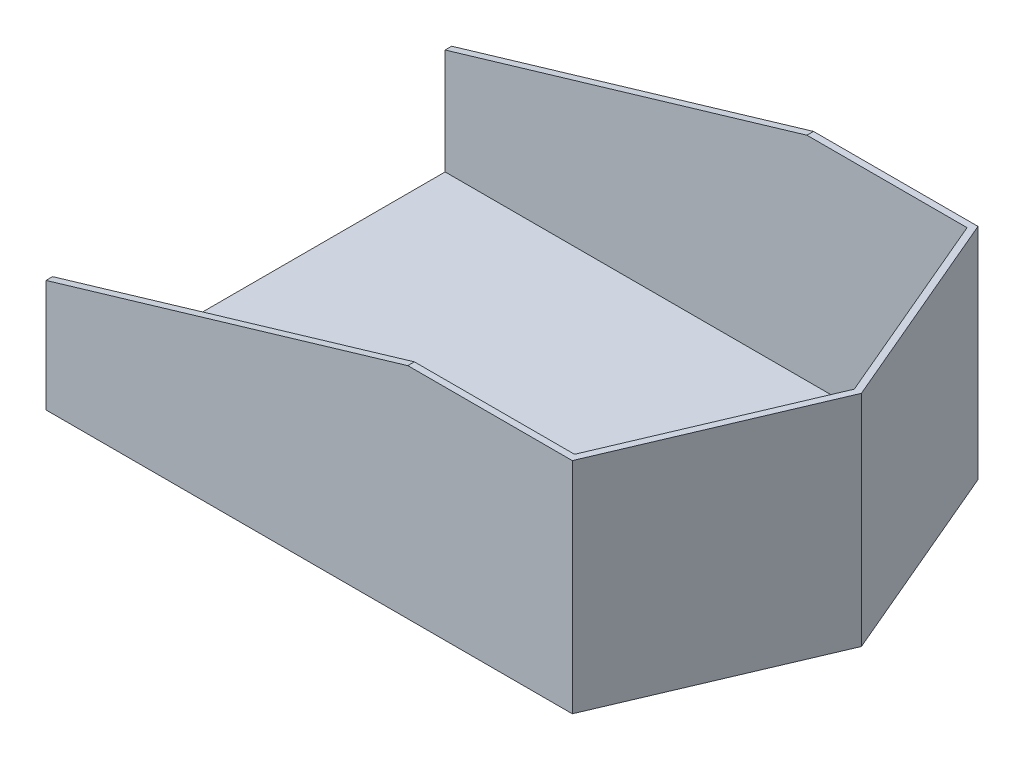
from build123d import *

# Parameters (mm, degrees)
BOSS_EXTRUDE1_DEPTH = 100
SHELL1_T            = -3
SKETCH2_W           = 3
SKETCH2_H           = 179
CUT_EXTRUDE1_DEPTH  = 97
CUT_EXTRUDE2_DEPTH  = 350.650985941


with BuildPart() as part:
    # Sketch1 → Boss-Extrude1 (new body)
    with BuildSketch(Plane(origin=(0, 0, 0), x_dir=(1, 0, 0), z_dir=(0, 1, 0))):
        Polygon((240, 185), (279.339957703, 92.5), (240, 0), (0, 0), (0, 185), align=None)
    extrude(amount=BOSS_EXTRUDE1_DEPTH)

    # Shell1
    shell1_openings = [part.faces().sort_by_distance(p)[0] for p in [
        (130.08332263, 100, -92.5),
    ]]
    offset(amount=SHELL1_T, openings=shell1_openings, kind=Kind.INTERSECTION)

    # Sketch2 → Cut-Extrude1 (cut)
    with BuildSketch(Plane(origin=(0, 100, 0), x_dir=(1, 0, 0), z_dir=(0, 1, 0))):
        with Locations((1.5, 92.5)):
            Rectangle(SKETCH2_W, SKETCH2_H)
    extrude(amount=-CUT_EXTRUDE1_DEPTH, mode=Mode.SUBTRACT)

    # Sketch3 → Cut-Extrude2 (cut, through all)
    with BuildSketch(Plane.XY):
        Polygon((0, 100), (0, 51.158972719), (164.988073302, 100), align=None)
    extrude(amount=-CUT_EXTRUDE2_DEPTH, mode=Mode.SUBTRACT)


solid = part.part
